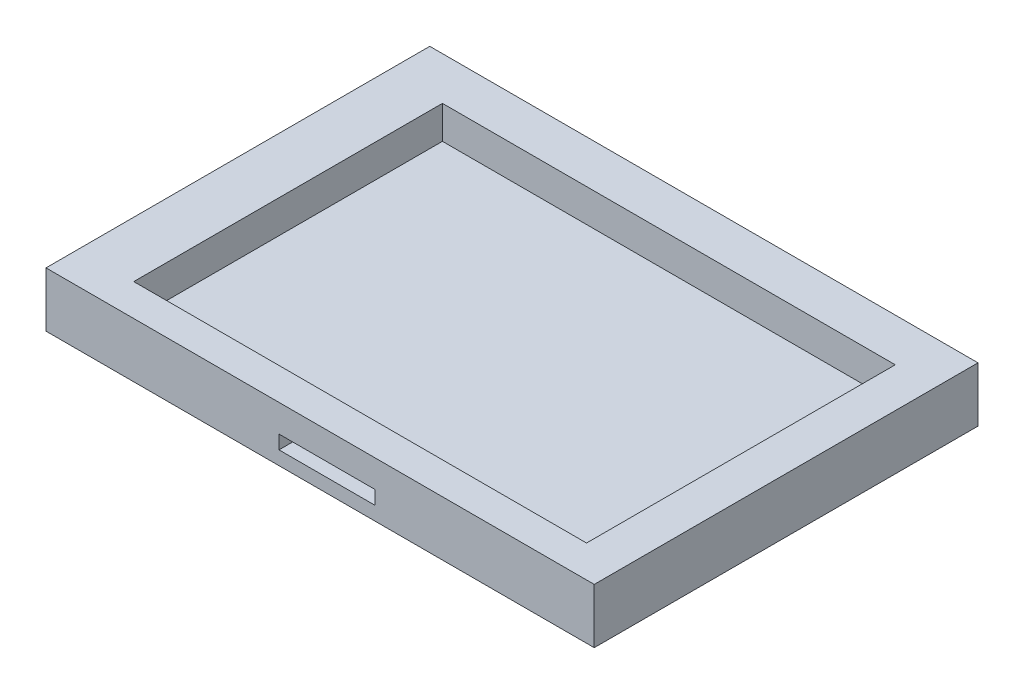
from build123d import *

# Parameters (mm, degrees)
SKETCH1_W           = 500
SKETCH1_H           = 350
BOSS_EXTRUDE1_DEPTH = 20
SKETCH2_W           = 412.975976351
SKETCH2_H           = 281.551553033
BOSS_EXTRUDE2_DEPTH = 30
SKETCH3_W           = 87.5
SKETCH3_H           = 12.5
CUT_EXTRUDE2_DEPTH  = 20


with BuildPart() as part:
    # Sketch1 → Boss-Extrude1 (new body)
    with BuildSketch(Plane(origin=(0, 0, 0), x_dir=(1, 0, 0), z_dir=(0, 1, 0))):
        Rectangle(SKETCH1_W, SKETCH1_H)
    extrude(amount=BOSS_EXTRUDE1_DEPTH)

    # Sketch2 → Boss-Extrude2 (add)
    with BuildSketch(Plane(origin=(0, 20, 0), x_dir=(1, 0, 0), z_dir=(0, 1, 0))):
        Polygon((-250, 175), (-199.158549183, 175), (250, 175), (250, 135.720991004), (250, -175), (213.817427168, -175), (-199.158549183, -175), (-250, -175), align=None)
        with Locations((7.329438993, -5.054785513)):
            Rectangle(SKETCH2_W, SKETCH2_H, mode=Mode.SUBTRACT)
    extrude(amount=BOSS_EXTRUDE2_DEPTH)

    # Sketch3 → Cut-Extrude2 (cut)
    with BuildSketch(Plane.XY.offset(175)):
        with Locations((6.25, 18.75)):
            Rectangle(SKETCH3_W, SKETCH3_H)
    extrude(amount=-CUT_EXTRUDE2_DEPTH, mode=Mode.SUBTRACT)


solid = part.part
